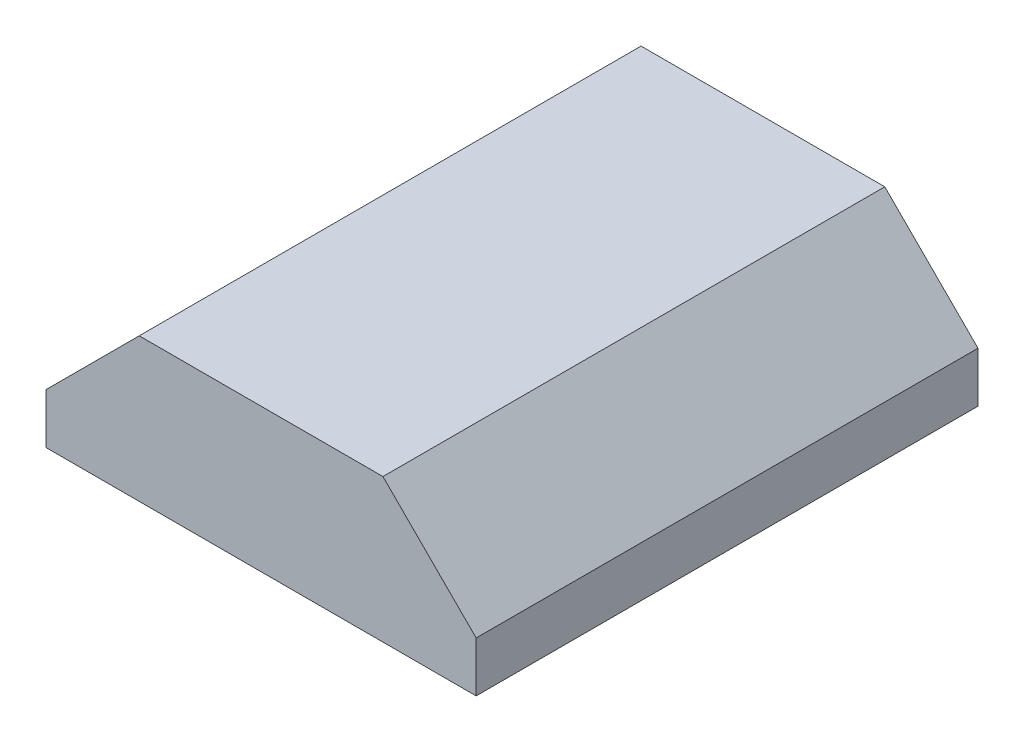
from build123d import *

# Parameters (mm, degrees)
AUFSATZ_LINEAR_AUSTRAGEN1_DEPTH = 14


with BuildPart() as part:
    # Skizze1 → Aufsatz-Linear austragen1 (new body)
    with BuildSketch(Plane.XY):
        Polygon((3.4, 1.808858787), (-3.4, 1.808858787), (-6, -0.791141213), (-6, -2.191141213), (6, -2.191141213), (6, -0.791141213), align=None)
    extrude(amount=AUFSATZ_LINEAR_AUSTRAGEN1_DEPTH)


solid = part.part
